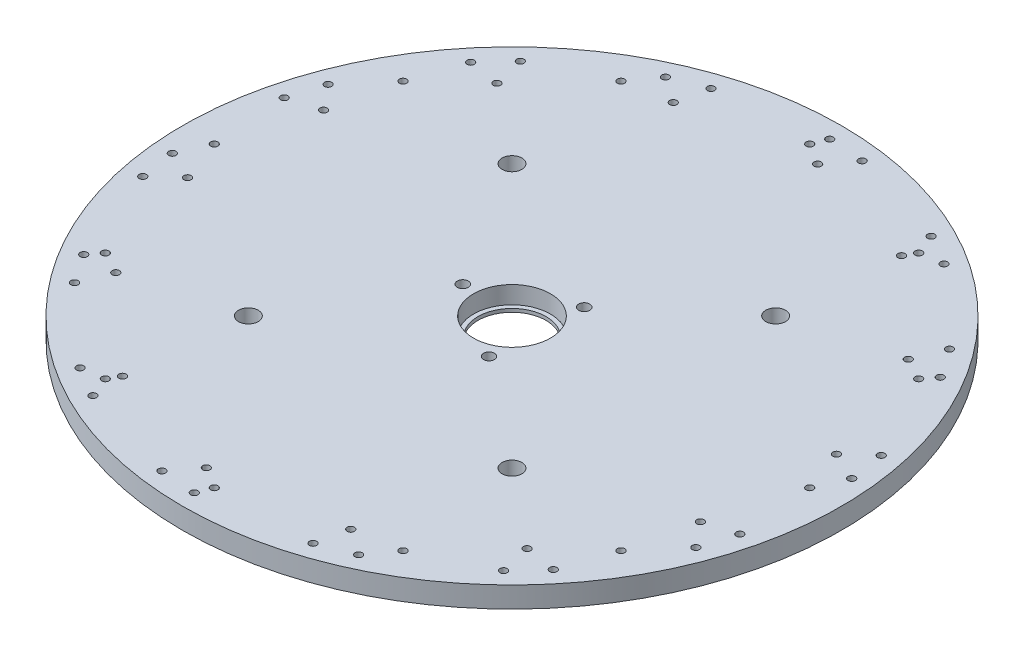
from build123d import *

# Parameters (mm, degrees)
SKETCH1_R           = 150
BOSS_EXTRUDE1_DEPTH = 9.52
SKETCH2_R           = 15.5
CUT_EXTRUDE1_DEPTH  = 213.345544808
SKETCH3_R           = 17.505
CUT_EXTRUDE2_DEPTH  = 8
SKETCH4_R           = 2.5
SKETCH4_R_2         = 1.65
CUT_EXTRUDE3_DEPTH  = 213.345544808
SKETCH6_R           = 1.65
CUT_EXTRUDE5_DEPTH  = 213.345544808
SKETCH7_R           = 4.5
CUT_EXTRUDE6_DEPTH  = 213.345544808


with BuildPart() as part:
    # Sketch1 → Boss-Extrude1 (new body)
    with BuildSketch(Plane(origin=(0, 0, 0), x_dir=(1, 0, 0), z_dir=(0, 1, 0))):
        with Locations(Location((0, 0, 0), (0, 0, 270))):
            Circle(SKETCH1_R)
    extrude(amount=BOSS_EXTRUDE1_DEPTH)

    # Sketch2 → Cut-Extrude1 (cut, through all)
    with BuildSketch(Plane(origin=(0, 9.52, 0), x_dir=(1, 0, 0), z_dir=(0, 1, 0))):
        with Locations(Location((0, 0, 0), (0, 0, 270))):
            Circle(SKETCH2_R)
    extrude(amount=-CUT_EXTRUDE1_DEPTH, mode=Mode.SUBTRACT)

    # Sketch3 → Cut-Extrude2 (cut)
    with BuildSketch(Plane(origin=(0, 9.52, 0), x_dir=(1, 0, 0), z_dir=(0, 1, 0))):
        with Locations(Location((0, 0, 0), (0, 0, 270))):
            Circle(SKETCH3_R)
    extrude(amount=-CUT_EXTRUDE2_DEPTH, mode=Mode.SUBTRACT)

    # Sketch4 → Cut-Extrude3 (cut, through all)
    with BuildSketch(Plane(origin=(0, 9.52, 0), x_dir=(1, 0, 0), z_dir=(0, 1, 0))):
        with Locations(Location((10.725147849, -21.193217308, 0), (0, 0, 270))):
            Circle(SKETCH4_R)
        with Locations(Location((-23.716438501, 1.308358157, 0), (0, 0, 270))):
            Circle(SKETCH4_R)
        with Locations(Location((12.991290652, 19.884859151, 0), (0, 0, 270))):
            Circle(SKETCH4_R)
        with Locations(Location((67.75, -117.346442213, 0), (0, 0, 270))):
            Circle(SKETCH4_R_2)
        with Locations(Location((0, -135.5, 0), (0, 0, 270))):
            Circle(SKETCH4_R_2)
        with Locations(Location((-67.75, -117.346442213, 0), (0, 0, 270))):
            Circle(SKETCH4_R_2)
        with Locations(Location((-117.346442213, -67.75, 0), (0, 0, 270))):
            Circle(SKETCH4_R_2)
        with Locations(Location((-135.5, 0, 0), (0, 0, 270))):
            Circle(SKETCH4_R_2)
        with Locations(Location((-117.346442213, 67.75, 0), (0, 0, 270))):
            Circle(SKETCH4_R_2)
        with Locations(Location((-67.75, 117.346442213, 0), (0, 0, 270))):
            Circle(SKETCH4_R_2)
        with Locations(Location((0, 135.5, 0), (0, 0, 270))):
            Circle(SKETCH4_R_2)
        with Locations(Location((67.75, 117.346442213, 0), (0, 0, 270))):
            Circle(SKETCH4_R_2)
        with Locations(Location((117.346442213, 67.75, 0), (0, 0, 270))):
            Circle(SKETCH4_R_2)
        with Locations(Location((135.5, 0, 0), (0, 0, 270))):
            Circle(SKETCH4_R_2)
        with Locations(Location((117.346442213, -67.75, 0), (0, 0, 270))):
            Circle(SKETCH4_R_2)
    extrude(amount=-CUT_EXTRUDE3_DEPTH, mode=Mode.SUBTRACT)

    # Sketch6 → Cut-Extrude5 (cut, through all)
    with BuildSketch(Plane(origin=(0, 0, 0), x_dir=(-1, 0, 0), z_dir=(0, -1, 0))):
        with Locations(Location((-63.964762127, 126.790217897, 0), (0, 0, 90))):
            Circle(SKETCH6_R)
        with Locations(Location((-77.821168587, 118.790217897, 0), (0, 0, 90))):
            Circle(SKETCH6_R)
        with Locations(Location((-64.892965357, 112.397913052, 0), (0, 0, 90))):
            Circle(SKETCH6_R)
        with Locations(Location((-9.698914748, 129.423022928, 0), (0, 0, 90))):
            Circle(SKETCH6_R)
        with Locations(Location((-2.618045494, 141.987309243, 0), (0, 0, 90))):
            Circle(SKETCH6_R)
        with Locations(Location((-18.573306249, 140.791627746, 0), (0, 0, 90))):
            Circle(SKETCH6_R)
        with Locations(Location((59.247207157, 129.062072633, 0), (0, 0, 90))):
            Circle(SKETCH6_R)
        with Locations(Location((44.353227178, 134.907529023, 0), (0, 0, 90))):
            Circle(SKETCH6_R)
        with Locations(Location((47.416124875, 120.814315845, 0), (0, 0, 90))):
            Circle(SKETCH6_R)
        with Locations(Location((109.377823811, 90.574509696, 0), (0, 0, 90))):
            Circle(SKETCH6_R)
        with Locations(Location((98.495060007, 102.303339645, 0), (0, 0, 90))):
            Circle(SKETCH6_R)
        with Locations(Location((95.139819447, 88.276851818, 0), (0, 0, 90))):
            Circle(SKETCH6_R)
        with Locations(Location((133.128738238, 49.436719183, 0), (0, 0, 90))):
            Circle(SKETCH6_R)
        with Locations(Location((124.019905964, 38.255074644, 0), (0, 0, 90))):
            Circle(SKETCH6_R)
        with Locations(Location((137.844821028, 34.14755429, 0), (0, 0, 90))):
            Circle(SKETCH6_R)
        with Locations(Location((141.394637144, -13.221449816, 0), (0, 0, 90))):
            Circle(SKETCH6_R)
        with Locations(Location((128.3363291, -19.343589231, 0), (0, 0, 90))):
            Circle(SKETCH6_R)
        with Locations(Location((139.009960885, -29.042743035, 0), (0, 0, 90))):
            Circle(SKETCH6_R)
        with Locations(Location((121.655594073, -73.260948528, 0), (0, 0, 90))):
            Circle(SKETCH6_R)
        with Locations(Location((112.642473144, -86.480768917, 0), (0, 0, 90))):
            Circle(SKETCH6_R)
        with Locations(Location((107.234168316, -73.111018025, 0), (0, 0, 90))):
            Circle(SKETCH6_R)
        with Locations(Location((64.892965357, -112.397913052, 0), (0, 0, 90))):
            Circle(SKETCH6_R)
        with Locations(Location((63.964762127, -126.790217897, 0), (0, 0, 90))):
            Circle(SKETCH6_R)
        with Locations(Location((77.821168587, -118.790217897, 0), (0, 0, 90))):
            Circle(SKETCH6_R)
        with Locations(Location((9.698914748, -129.423022928, 0), (0, 0, 90))):
            Circle(SKETCH6_R)
        with Locations(Location((2.618045494, -141.987309243, 0), (0, 0, 90))):
            Circle(SKETCH6_R)
        with Locations(Location((18.573306249, -140.791627746, 0), (0, 0, 90))):
            Circle(SKETCH6_R)
        with Locations(Location((-44.353227178, -134.907529023, 0), (0, 0, 90))):
            Circle(SKETCH6_R)
        with Locations(Location((-59.247207157, -129.062072633, 0), (0, 0, 90))):
            Circle(SKETCH6_R)
        with Locations(Location((-47.416124875, -120.814315845, 0), (0, 0, 90))):
            Circle(SKETCH6_R)
        with Locations(Location((-98.495060007, -102.303339645, 0), (0, 0, 90))):
            Circle(SKETCH6_R)
        with Locations(Location((-109.377823811, -90.574509696, 0), (0, 0, 90))):
            Circle(SKETCH6_R)
        with Locations(Location((-95.139819447, -88.276851818, 0), (0, 0, 90))):
            Circle(SKETCH6_R)
        with Locations(Location((-124.019905964, -38.255074644, 0), (0, 0, 90))):
            Circle(SKETCH6_R)
        with Locations(Location((-137.844821028, -34.14755429, 0), (0, 0, 90))):
            Circle(SKETCH6_R)
        with Locations(Location((-133.128738238, -49.436719183, 0), (0, 0, 90))):
            Circle(SKETCH6_R)
        with Locations(Location((-128.3363291, 19.343589231, 0), (0, 0, 90))):
            Circle(SKETCH6_R)
        with Locations(Location((-141.394637144, 13.221449816, 0), (0, 0, 90))):
            Circle(SKETCH6_R)
        with Locations(Location((-139.009960885, 29.042743035, 0), (0, 0, 90))):
            Circle(SKETCH6_R)
        with Locations(Location((-107.234168316, 73.111018025, 0), (0, 0, 90))):
            Circle(SKETCH6_R)
        with Locations(Location((-121.655594073, 73.260948528, 0), (0, 0, 90))):
            Circle(SKETCH6_R)
        with Locations(Location((-112.642473144, 86.480768917, 0), (0, 0, 90))):
            Circle(SKETCH6_R)
    extrude(amount=-CUT_EXTRUDE5_DEPTH, mode=Mode.SUBTRACT)

    # Sketch7 → Cut-Extrude6 (cut, through all)
    with BuildSketch(Plane(origin=(0, 9.52, 0), x_dir=(1, 0, 0), z_dir=(0, 1, 0))):
        with Locations(Location((-60, -60, 0), (0, 0, 270))):
            Circle(SKETCH7_R)
        with Locations(Location((60, -60, 0), (0, 0, 270))):
            Circle(SKETCH7_R)
        with Locations(Location((60, 60, 0), (0, 0, 270))):
            Circle(SKETCH7_R)
        with Locations(Location((-60, 60, 0), (0, 0, 270))):
            Circle(SKETCH7_R)
    extrude(amount=-CUT_EXTRUDE6_DEPTH, mode=Mode.SUBTRACT)


solid = part.part
